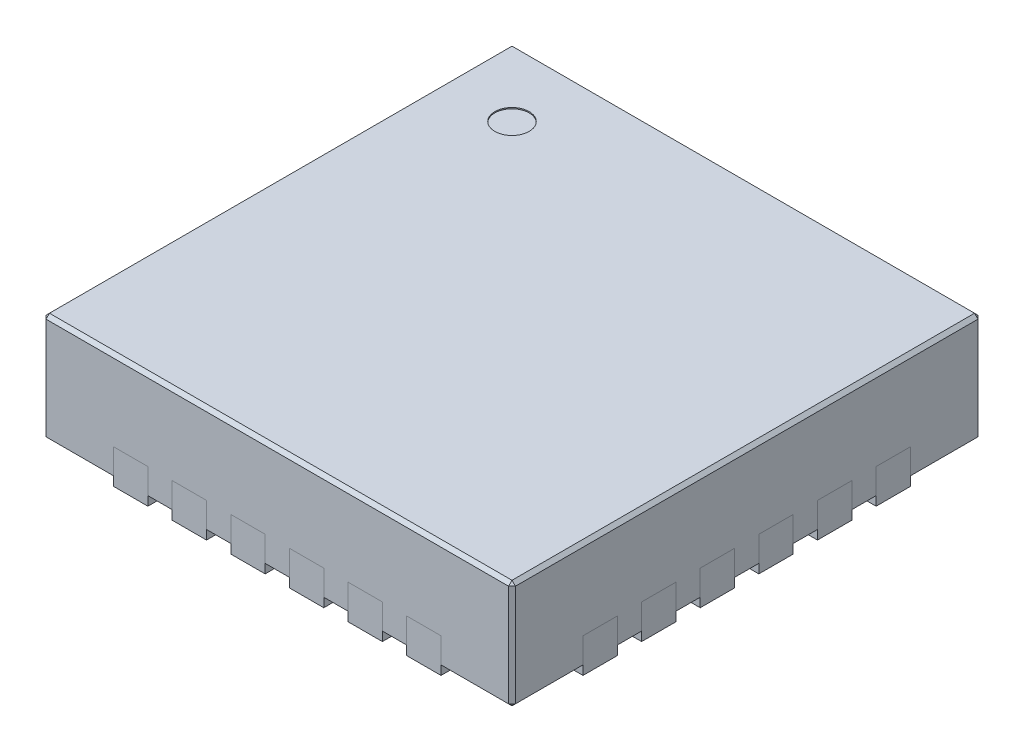
from build123d import *

# Parameters (mm, degrees)
EXTRUDE_1_DEPTH     = 0.3
SKETCH_1_W          = 0.4
SKETCH_1_H          = 0.3
EXTRUDE_1_2_DEPTH   = 0.3
EXTRUDE_1_3_DEPTH   = 0.3
EXTRUDE_1_4_DEPTH   = 0.3
SKETCH_1_W_2        = 0.3
SKETCH_1_H_2        = 0.4
EXTRUDE_1_5_DEPTH   = 0.3
EXTRUDE_1_6_DEPTH   = 0.3
EXTRUDE_1_7_DEPTH   = 0.3
EXTRUDE_1_8_DEPTH   = 0.3
EXTRUDE_1_9_DEPTH   = 0.3
EXTRUDE_1_10_DEPTH  = 0.3
EXTRUDE_1_11_DEPTH  = 0.3
EXTRUDE_1_12_DEPTH  = 0.3
EXTRUDE_1_13_DEPTH  = 0.3
EXTRUDE_1_14_DEPTH  = 0.3
EXTRUDE_1_15_DEPTH  = 0.3
EXTRUDE_1_16_DEPTH  = 0.3
EXTRUDE_1_17_DEPTH  = 0.3
EXTRUDE_1_18_DEPTH  = 0.3
EXTRUDE_1_19_DEPTH  = 0.3
EXTRUDE_1_20_DEPTH  = 0.3
EXTRUDE_1_21_DEPTH  = 0.3
EXTRUDE_1_22_DEPTH  = 0.3
EXTRUDE_1_23_DEPTH  = 0.3
EXTRUDE_1_24_DEPTH  = 0.3
EXTRUDE_1_25_DEPTH  = 0.3
EXTRUDE_START       = 0.05
EXTRUDE_2_DEPTH     = 0.25
EXTRUDE_START_2     = 0.3
SKETCH_1_5_W        = 4.1
SKETCH_1_5_H        = 4.1
EXTRUDE_3_DEPTH     = 0.7
SKETCH_2_R          = 0.15
CUT_EXTRUDE_1_DEPTH = 0.01
CHAMFER_1_SIZE      = 0.03


with BuildPart() as part:
    # Эскиз1 → Бобышка-Вытянуть1 (new body)
    with BuildSketch(Plane(origin=(0, 0, 0), x_dir=(1, 0, 0), z_dir=(0, 1, 0))):
        Polygon((-2.05, -1.13), (-2.05, -1.43), (-1.85, -1.43), (-1.65, -1.28), (-1.65, -1.13), align=None)
    extrude(amount=EXTRUDE_1_DEPTH)


with BuildPart() as body_2:
    # Эскиз1 → Extrude 1 2 (new body)
    with BuildSketch(Plane(origin=(0, 0, 0), x_dir=(1, 0, 0), z_dir=(0, 1, 0))):
        with Locations((-1.85, -0.768)):
            Rectangle(SKETCH_1_W, SKETCH_1_H)
    extrude(amount=EXTRUDE_1_2_DEPTH)


with BuildPart() as body_3:
    # Эскиз1 → Extrude 1 3 (new body)
    with BuildSketch(Plane(origin=(0, 0, 0), x_dir=(1, 0, 0), z_dir=(0, 1, 0))):
        Polygon((-1.43, -1.85), (-1.43, -2.05), (-1.13, -2.05), (-1.13, -1.65), (-1.28, -1.65), align=None)
    extrude(amount=EXTRUDE_1_3_DEPTH)


with BuildPart() as body_4:
    # Эскиз1 → Extrude 1 4 (new body)
    with BuildSketch(Plane(origin=(0, 0, 0), x_dir=(1, 0, 0), z_dir=(0, 1, 0))):
        with Locations((-1.85, -0.256)):
            Rectangle(SKETCH_1_W, SKETCH_1_H)
    extrude(amount=EXTRUDE_1_4_DEPTH)


with BuildPart() as body_5:
    # Эскиз1 → Extrude 1 5 (new body)
    with BuildSketch(Plane(origin=(0, 0, 0), x_dir=(1, 0, 0), z_dir=(0, 1, 0))):
        with Locations((-0.768, -1.85)):
            Rectangle(SKETCH_1_W_2, SKETCH_1_H_2)
    extrude(amount=EXTRUDE_1_5_DEPTH)


with BuildPart() as body_6:
    # Эскиз1 → Extrude 1 6 (new body)
    with BuildSketch(Plane(origin=(0, 0, 0), x_dir=(1, 0, 0), z_dir=(0, 1, 0))):
        with Locations((-1.85, 0.256)):
            Rectangle(SKETCH_1_W, SKETCH_1_H)
    extrude(amount=EXTRUDE_1_6_DEPTH)


with BuildPart() as body_7:
    # Эскиз1 → Extrude 1 7 (new body)
    with BuildSketch(Plane(origin=(0, 0, 0), x_dir=(1, 0, 0), z_dir=(0, 1, 0))):
        with Locations((-0.256, -1.85)):
            Rectangle(SKETCH_1_W_2, SKETCH_1_H_2)
    extrude(amount=EXTRUDE_1_7_DEPTH)


with BuildPart() as body_8:
    # Эскиз1 → Extrude 1 8 (new body)
    with BuildSketch(Plane(origin=(0, 0, 0), x_dir=(1, 0, 0), z_dir=(0, 1, 0))):
        with Locations((-1.85, 0.768)):
            Rectangle(SKETCH_1_W, SKETCH_1_H)
    extrude(amount=EXTRUDE_1_8_DEPTH)


with BuildPart() as body_9:
    # Эскиз1 → Extrude 1 9 (new body)
    with BuildSketch(Plane(origin=(0, 0, 0), x_dir=(1, 0, 0), z_dir=(0, 1, 0))):
        with Locations((0.256, -1.85)):
            Rectangle(SKETCH_1_W_2, SKETCH_1_H_2)
    extrude(amount=EXTRUDE_1_9_DEPTH)


with BuildPart() as body_10:
    # Эскиз1 → Extrude 1 10 (new body)
    with BuildSketch(Plane(origin=(0, 0, 0), x_dir=(1, 0, 0), z_dir=(0, 1, 0))):
        Polygon((-2.05, 1.43), (-2.05, 1.13), (-1.65, 1.13), (-1.65, 1.28), (-1.85, 1.43), align=None)
    extrude(amount=EXTRUDE_1_10_DEPTH)


with BuildPart() as body_11:
    # Эскиз1 → Extrude 1 11 (new body)
    with BuildSketch(Plane(origin=(0, 0, 0), x_dir=(1, 0, 0), z_dir=(0, 1, 0))):
        with Locations((0.768, -1.85)):
            Rectangle(SKETCH_1_W_2, SKETCH_1_H_2)
    extrude(amount=EXTRUDE_1_11_DEPTH)


with BuildPart() as body_12:
    # Эскиз1 → Extrude 1 12 (new body)
    with BuildSketch(Plane(origin=(0, 0, 0), x_dir=(1, 0, 0), z_dir=(0, 1, 0))):
        Polygon((1.13, -1.65), (1.13, -2.05), (1.43, -2.05), (1.43, -1.85), (1.28, -1.65), align=None)
    extrude(amount=EXTRUDE_1_12_DEPTH)


with BuildPart() as body_13:
    # Эскиз1 → Extrude 1 13 (new body)
    with BuildSketch(Plane(origin=(0, 0, 0), x_dir=(1, 0, 0), z_dir=(0, 1, 0))):
        Polygon((-1.13, 2.05), (-1.43, 2.05), (-1.43, 1.85), (-1.28, 1.65), (-1.13, 1.65), align=None)
    extrude(amount=EXTRUDE_1_13_DEPTH)


with BuildPart() as body_14:
    # Эскиз1 → Extrude 1 14 (new body)
    with BuildSketch(Plane(origin=(0, 0, 0), x_dir=(1, 0, 0), z_dir=(0, 1, 0))):
        with Locations((-0.768, 1.85)):
            Rectangle(SKETCH_1_W_2, SKETCH_1_H_2)
    extrude(amount=EXTRUDE_1_14_DEPTH)


with BuildPart() as body_15:
    # Эскиз1 → Extrude 1 15 (new body)
    with BuildSketch(Plane(origin=(0, 0, 0), x_dir=(1, 0, 0), z_dir=(0, 1, 0))):
        Polygon((1.85, -1.43), (2.05, -1.43), (2.05, -1.13), (1.65, -1.13), (1.65, -1.28), align=None)
    extrude(amount=EXTRUDE_1_15_DEPTH)


with BuildPart() as body_16:
    # Эскиз1 → Extrude 1 16 (new body)
    with BuildSketch(Plane(origin=(0, 0, 0), x_dir=(1, 0, 0), z_dir=(0, 1, 0))):
        with Locations((-0.256, 1.85)):
            Rectangle(SKETCH_1_W_2, SKETCH_1_H_2)
    extrude(amount=EXTRUDE_1_16_DEPTH)


with BuildPart() as body_17:
    # Эскиз1 → Extrude 1 17 (new body)
    with BuildSketch(Plane(origin=(0, 0, 0), x_dir=(1, 0, 0), z_dir=(0, 1, 0))):
        with Locations((1.85, -0.768)):
            Rectangle(SKETCH_1_W, SKETCH_1_H)
    extrude(amount=EXTRUDE_1_17_DEPTH)


with BuildPart() as body_18:
    # Эскиз1 → Extrude 1 18 (new body)
    with BuildSketch(Plane(origin=(0, 0, 0), x_dir=(1, 0, 0), z_dir=(0, 1, 0))):
        with Locations((0.256, 1.85)):
            Rectangle(SKETCH_1_W_2, SKETCH_1_H_2)
    extrude(amount=EXTRUDE_1_18_DEPTH)


with BuildPart() as body_19:
    # Эскиз1 → Extrude 1 19 (new body)
    with BuildSketch(Plane(origin=(0, 0, 0), x_dir=(1, 0, 0), z_dir=(0, 1, 0))):
        with Locations((1.85, -0.256)):
            Rectangle(SKETCH_1_W, SKETCH_1_H)
    extrude(amount=EXTRUDE_1_19_DEPTH)


with BuildPart() as body_20:
    # Эскиз1 → Extrude 1 20 (new body)
    with BuildSketch(Plane(origin=(0, 0, 0), x_dir=(1, 0, 0), z_dir=(0, 1, 0))):
        with Locations((0.768, 1.85)):
            Rectangle(SKETCH_1_W_2, SKETCH_1_H_2)
    extrude(amount=EXTRUDE_1_20_DEPTH)


with BuildPart() as body_21:
    # Эскиз1 → Extrude 1 21 (new body)
    with BuildSketch(Plane(origin=(0, 0, 0), x_dir=(1, 0, 0), z_dir=(0, 1, 0))):
        with Locations((1.85, 0.256)):
            Rectangle(SKETCH_1_W, SKETCH_1_H)
    extrude(amount=EXTRUDE_1_21_DEPTH)


with BuildPart() as body_22:
    # Эскиз1 → Extrude 1 22 (new body)
    with BuildSketch(Plane(origin=(0, 0, 0), x_dir=(1, 0, 0), z_dir=(0, 1, 0))):
        Polygon((1.43, 2.05), (1.13, 2.05), (1.13, 1.65), (1.28, 1.65), (1.43, 1.85), align=None)
    extrude(amount=EXTRUDE_1_22_DEPTH)


with BuildPart() as body_23:
    # Эскиз1 → Extrude 1 23 (new body)
    with BuildSketch(Plane(origin=(0, 0, 0), x_dir=(1, 0, 0), z_dir=(0, 1, 0))):
        with Locations((1.85, 0.768)):
            Rectangle(SKETCH_1_W, SKETCH_1_H)
    extrude(amount=EXTRUDE_1_23_DEPTH)


with BuildPart() as body_24:
    # Эскиз1 → Extrude 1 24 (new body)
    with BuildSketch(Plane(origin=(0, 0, 0), x_dir=(1, 0, 0), z_dir=(0, 1, 0))):
        Polygon((1.65, 1.13), (2.05, 1.13), (2.05, 1.43), (1.85, 1.43), (1.65, 1.28), align=None)
    extrude(amount=EXTRUDE_1_24_DEPTH)


with BuildPart() as body_25:
    # Эскиз1 → Extrude 1 25 (new body)
    with BuildSketch(Plane(origin=(0, 0, 0), x_dir=(1, 0, 0), z_dir=(0, 1, 0))):
        Polygon((-0.909314575, 1.475), (-1.475, 0.909314575), (-1.475, -1.475), (1.475, -1.475), (1.475, 1.475), align=None)
    extrude(amount=EXTRUDE_1_25_DEPTH)


with BuildPart() as body_26:
    # Эскиз1<3> → Бобышка-Вытянуть2 (new body)
    with BuildSketch(Plane(origin=(0, 0, 0), x_dir=(1, 0, 0), z_dir=(0, 1, 0)).offset(EXTRUDE_START)):
        Polygon((-1.85, -1.43), (-2.05, -1.43), (-2.05, -2.05), (-1.43, -2.05), (-1.43, -1.85), (-1.28, -1.65), (-1.13, -1.65), (-1.13, -2.05), (-0.918, -2.05), (-0.918, -1.65), (-0.618, -1.65), (-0.618, -2.05), (-0.406, -2.05), (-0.406, -1.65), (-0.106, -1.65), (-0.106, -2.05), (0.106, -2.05), (0.106, -1.65), (0.406, -1.65), (0.406, -2.05), (0.618, -2.05), (0.618, -1.65), (0.918, -1.65), (0.918, -2.05), (1.13, -2.05), (1.13, -1.65), (1.28, -1.65), (1.43, -1.85), (1.43, -2.05), (2.05, -2.05), (2.05, -1.43), (1.85, -1.43), (1.65, -1.28), (1.65, -1.13), (2.05, -1.13), (2.05, -0.918), (1.65, -0.918), (1.65, -0.618), (2.05, -0.618), (2.05, -0.406), (1.65, -0.406), (1.65, -0.106), (2.05, -0.106), (2.05, 0.106), (1.65, 0.106), (1.65, 0.406), (2.05, 0.406), (2.05, 0.618), (1.65, 0.618), (1.65, 0.918), (2.05, 0.918), (2.05, 1.13), (1.65, 1.13), (1.65, 1.28), (1.85, 1.43), (2.05, 1.43), (2.05, 2.05), (1.43, 2.05), (1.43, 1.85), (1.28, 1.65), (1.13, 1.65), (1.13, 2.05), (0.918, 2.05), (0.918, 1.65), (0.618, 1.65), (0.618, 2.05), (0.406, 2.05), (0.406, 1.65), (0.106, 1.65), (0.106, 2.05), (-0.106, 2.05), (-0.106, 1.65), (-0.406, 1.65), (-0.406, 2.05), (-0.618, 2.05), (-0.618, 1.65), (-0.918, 1.65), (-0.918, 2.05), (-1.13, 2.05), (-1.13, 1.65), (-1.28, 1.65), (-1.43, 1.85), (-1.43, 2.05), (-2.05, 2.05), (-2.05, 1.43), (-1.85, 1.43), (-1.65, 1.28), (-1.65, 1.13), (-2.05, 1.13), (-2.05, 0.918), (-1.65, 0.918), (-1.65, 0.618), (-2.05, 0.618), (-2.05, 0.406), (-1.65, 0.406), (-1.65, 0.106), (-2.05, 0.106), (-2.05, -0.106), (-1.65, -0.106), (-1.65, -0.406), (-2.05, -0.406), (-2.05, -0.618), (-1.65, -0.618), (-1.65, -0.918), (-2.05, -0.918), (-2.05, -1.13), (-1.65, -1.13), (-1.65, -1.28), align=None)
        Polygon((-1.475, -1.475), (-1.475, 0.909314575), (-0.909314575, 1.475), (1.475, 1.475), (1.475, -1.475), align=None, mode=Mode.SUBTRACT)
    extrude(amount=EXTRUDE_2_DEPTH)

    # Эскиз1<5> → Бобышка-Вытянуть3 (add)
    with BuildSketch(Plane(origin=(0, 0, 0), x_dir=(1, 0, 0), z_dir=(0, 1, 0)).offset(EXTRUDE_START_2)):
        Rectangle(SKETCH_1_5_W, SKETCH_1_5_H)
    extrude(amount=EXTRUDE_3_DEPTH)

    # Эскиз2 → Вырез-Вытянуть1 (cut)
    with BuildSketch(Plane(origin=(0, 1, 0), x_dir=(1, 0, 0), z_dir=(0, 1, 0))):
        with Locations((-1.45, 1.45)):
            Circle(SKETCH_2_R)
    extrude(amount=-CUT_EXTRUDE_1_DEPTH, mode=Mode.SUBTRACT)

    # Фаска1
    chamfer_1_edges = [body_26.edges().sort_by_distance(p)[0] for p in [
        (1.024, 0.05, 2.05),
        (0.512, 0.05, 2.05),
        (0, 0.05, 2.05),
        (-0.512, 0.05, 2.05),
        (-1.024, 0.05, 2.05),
        (-2.05, 0.05, 1.024),
        (-2.05, 0.05, 0.512),
        (-2.05, 0.05, 0),
        (-2.05, 0.05, -0.512),
        (-2.05, 0.05, -1.024),
        (-1.024, 0.05, -2.05),
        (-0.512, 0.05, -2.05),
        (0, 0.05, -2.05),
        (0.512, 0.05, -2.05),
        (1.024, 0.05, -2.05),
        (2.05, 0.05, -1.024),
        (2.05, 0.05, -0.512),
        (2.05, 0.05, 0),
        (2.05, 0.05, 0.512),
        (2.05, 0.05, 1.024),
        (1.74, 0.05, 2.05),
        (-1.74, 0.05, 2.05),
        (-2.05, 0.05, 1.74),
        (-2.05, 0.05, -1.74),
        (-1.74, 0.05, -2.05),
        (1.74, 0.05, -2.05),
        (2.05, 0.05, -1.74),
        (2.05, 0.05, 1.74),
        (2.05, 0.525, -2.05),
        (2.05, 0.525, 2.05),
        (-2.05, 0.525, 2.05),
        (-2.05, 0.525, -2.05),
        (0, 1, -2.05),
        (2.05, 1, 0),
        (0, 1, 2.05),
        (-2.05, 1, 0),
    ]]
    chamfer(chamfer_1_edges, length=CHAMFER_1_SIZE)


solid = Compound([part.part, body_2.part, body_3.part, body_4.part, body_5.part, body_6.part, body_7.part, body_8.part, body_9.part, body_10.part, body_11.part, body_12.part, body_13.part, body_14.part, body_15.part, body_16.part, body_17.part, body_18.part, body_19.part, body_20.part, body_21.part, body_22.part, body_23.part, body_24.part, body_25.part, body_26.part])
